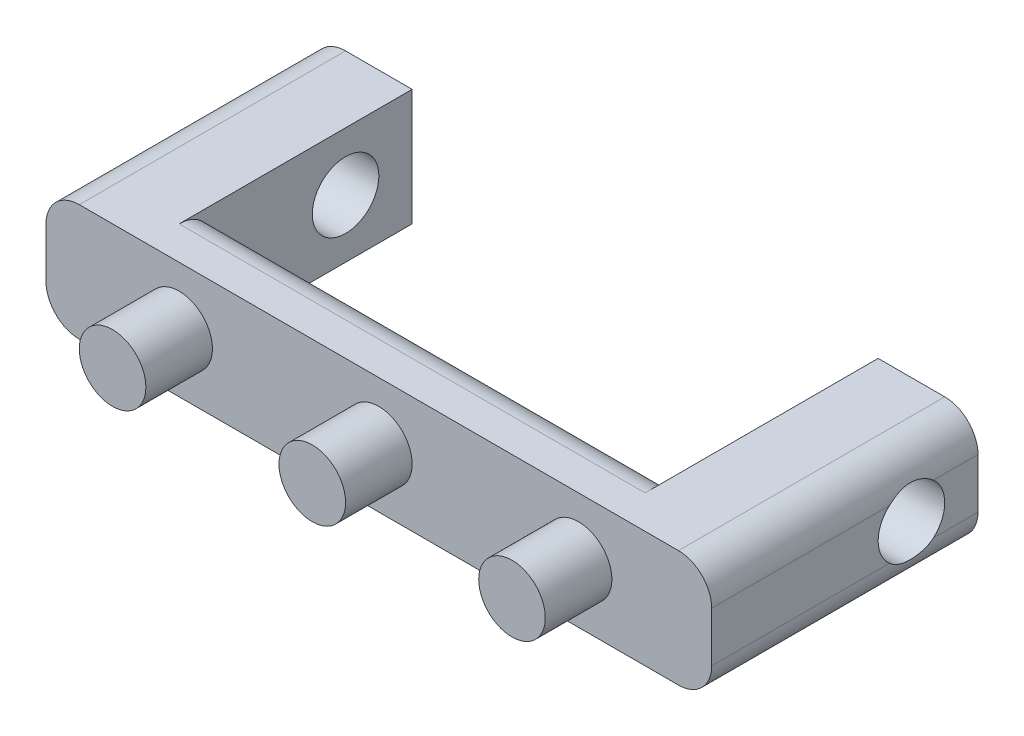
from build123d import *

# Parameters (mm, degrees)
SALIENTE_EXTRUIR1_DEPTH = 3.5
CROQUIS2_R              = 1
SALIENTE_EXTRUIR2_DEPTH = 2
REDONDEO1_R             = 1
CROQUIS3_R              = 1
CORTAR_EXTRUIR1_DEPTH   = 20.111514854


with BuildPart() as part:
    # Croquis1 → Saliente-Extruir1 (new body)
    with BuildSketch(Plane(origin=(0, 0, 0), x_dir=(1, 0, 0), z_dir=(0, 1, 0))):
        Polygon((10, 0), (-10, 0), (-10, 8), (-7, 8), (-7, 2), (7, 2), (7, 8), (10, 8), align=None)
    extrude(amount=SALIENTE_EXTRUIR1_DEPTH)

    # Croquis2 → Saliente-Extruir2 (add)
    with BuildSketch(Plane.XY):
        with Locations(Location((0, 1.75, 0), (0, 0, 180))):
            Circle(CROQUIS2_R)
        with Locations(Location((-6, 1.75, 0), (0, 0, 180))):
            Circle(CROQUIS2_R)
        with Locations(Location((6, 1.75, 0), (0, 0, 180))):
            Circle(CROQUIS2_R)
    extrude(amount=SALIENTE_EXTRUIR2_DEPTH)

    # Redondeo1
    redondeo1_edges = [part.edges().sort_by_distance(p)[0] for p in [
        (0, 0, -2),
        (-10, 3.5, -4),
        (10, 3.5, -4),
        (0, 3.5, -2),
        (10, 0, -4),
        (-10, 0, -4),
    ]]
    fillet(redondeo1_edges, radius=REDONDEO1_R)

    # Croquis3 → Cortar-Extruir1 (cut, through all)
    with BuildSketch(Plane(origin=(-7, 0, 0), x_dir=(0, 0, -1), z_dir=(1, 0, 0))):
        with Locations((6, 1.75)):
            Circle(CROQUIS3_R)
    cortar_extruir1 = extrude(amount=-CORTAR_EXTRUIR1_DEPTH, mode=Mode.SUBTRACT)

    # Simetría3: Cortar-Extruir1 across plane
    add(cortar_extruir1.mirror(Plane(origin=(0, 0, 0), x_dir=(0, 0, 1), z_dir=(1, 0, 0))), mode=Mode.SUBTRACT)


solid = part.part
